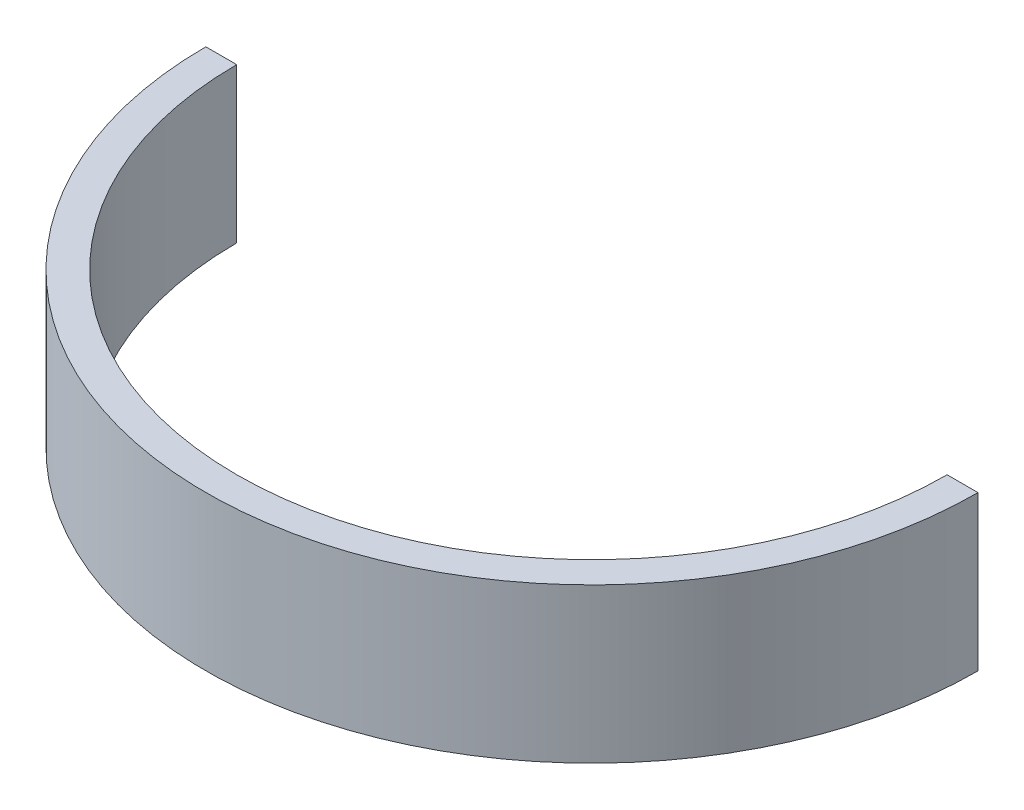
from build123d import *

# Parameters (mm, degrees)
EXTRUDE_1_DEPTH = 20


with BuildPart() as part:
    # 草图1 → 凸台-拉伸1 (new body)
    with BuildSketch(Plane(origin=(0, 0, 0), x_dir=(1, 0, 0), z_dir=(0, 1, 0))):
        with BuildLine():
            Line((-50, 0), (-46, 0))
            ThreePointArc((-46, 0), (0, -46), (46, 0))
            Line((46, 0), (50, 0))
            ThreePointArc((50, 0), (0, -50), (-50, 0))
        make_face()
    extrude(amount=EXTRUDE_1_DEPTH)


solid = part.part
